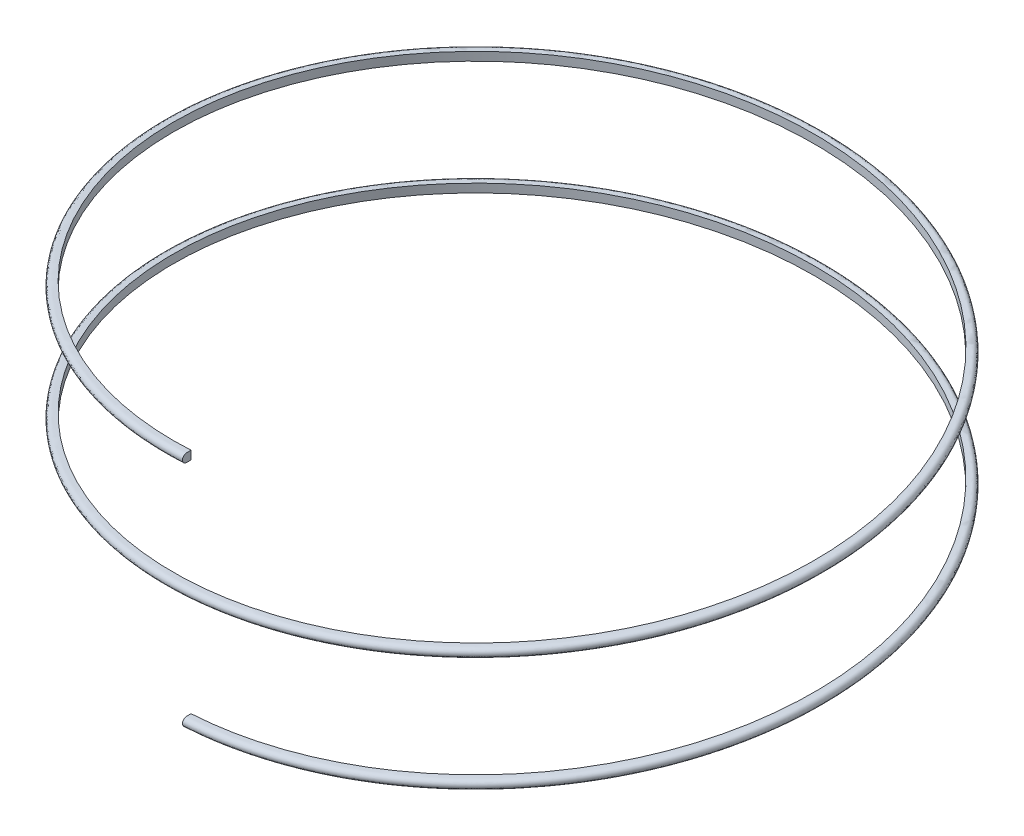
from build123d import *

# Parameters (mm, degrees)
THREAD_SWEEP_PITCH  = 13.387
THREAD_SWEEP_HEIGHT = 26.774
THREAD_SWEEP_RADIUS = 37.65594512


with BuildPart() as part:
    # Thread Sweep: sweep along a helix
    with BuildLine() as thread_sweep_path:
        Helix(THREAD_SWEEP_PITCH, THREAD_SWEEP_HEIGHT, THREAD_SWEEP_RADIUS, center=(0, 0, 0), direction=(0, 1, 0))
    # Thread Sketch → Thread Sweep (sweep)
    with BuildSketch(Plane(origin=(0, 0, 0), x_dir=(0, 0, -1), z_dir=(1, 0, 0))):
        with BuildLine():
            Line((-37.65594512, 0), (-37.65594512, -1))
            Line((-37.65594512, -1), (-38.15594512, -1))
            ThreePointArc((-38.15594512, -1), (-38.65594512, -0.5), (-38.15594512, 0))
            Line((-38.15594512, 0), (-37.65594512, 0))
        make_face()
    sweep(path=thread_sweep_path.line, is_frenet=True)


solid = part.part
